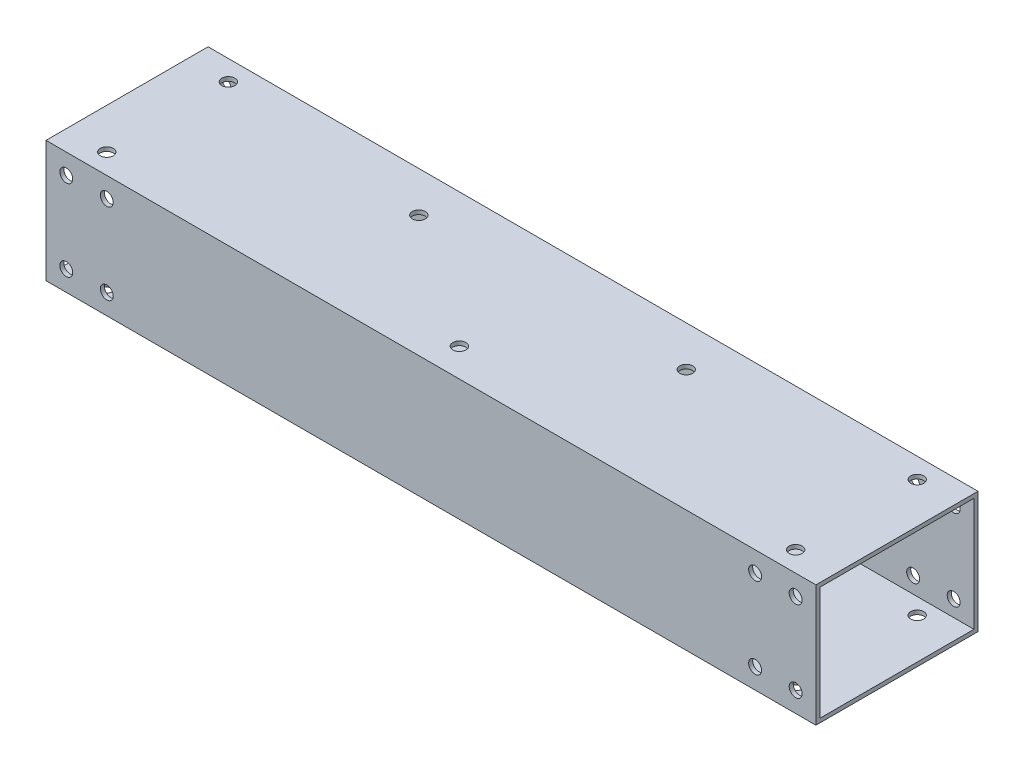
from build123d import *

# Parameters (mm, degrees)
SKETCH_1_W               = 40
SKETCH_1_H               = 30
SKETCH_1_W_2             = 38
SKETCH_1_H_2             = 28
EXTRUDE_1_DEPTH          = 95
CUT_EXTRUDE_1_DEPTH      = 102.612007165
CUT_EXTRUDE_1_DEPTH_BACK = 102.612007165
SKETCH_2_R               = 1.6
SKETCH_3_R               = 1.6
CUT_EXTRUDE_2_DEPTH      = 105.16333328


with BuildPart() as part:
    # 草图1 → 凸台-拉伸1 (new, symmetric)
    with BuildSketch(Plane(origin=(0, 0, 0), x_dir=(0, 0, -1), z_dir=(1, 0, 0))):
        Rectangle(SKETCH_1_W, SKETCH_1_H)
        Rectangle(SKETCH_1_W_2, SKETCH_1_H_2, mode=Mode.SUBTRACT)
    extrude(amount=EXTRUDE_1_DEPTH, both=True)

    # 草图2 → 切除-拉伸1 (cut, two sides: drawn at the far end of the back side and taken through both)
    with BuildSketch(Plane(origin=(0, 15, 0), x_dir=(1, 0, 0), z_dir=(0, 1, 0)).offset(-CUT_EXTRUDE_1_DEPTH_BACK)):
        with Locations(Location((0, -13, 0), (0, 0, 270))):
            Circle(SKETCH_2_R)
        with Locations(Location((-33, 10, 0), (0, 0, 270))):
            Circle(SKETCH_2_R)
        with Locations(Location((33, 10, 0), (0, 0, 270))):
            Circle(SKETCH_2_R)
        with Locations(Location((-85, 15, 0), (0, 0, 270))):
            Circle(SKETCH_2_R)
        with Locations(Location((-85, -15, 0), (0, 0, 270))):
            Circle(SKETCH_2_R)
        with Locations(Location((85, -15, 0), (0, 0, 270))):
            Circle(SKETCH_2_R)
        with Locations(Location((85, 15, 0), (0, 0, 270))):
            Circle(SKETCH_2_R)
    extrude(amount=CUT_EXTRUDE_1_DEPTH + CUT_EXTRUDE_1_DEPTH_BACK, mode=Mode.SUBTRACT)

    # 草图3 → 切除-拉伸2 (cut, through all)
    with BuildSketch(Plane.XY.offset(20)):
        with Locations((-90, 10)):
            Circle(SKETCH_3_R)
        with Locations(Location((-90, -10, 0), (0, 0, 270))):
            Circle(SKETCH_3_R)
        with Locations((-80, 10)):
            Circle(SKETCH_3_R)
        with Locations(Location((-80, -10, 0), (0, 0, 270))):
            Circle(SKETCH_3_R)
        with Locations((80, -10)):
            Circle(SKETCH_3_R)
        with Locations(Location((80, 10, 0), (0, 0, 270))):
            Circle(SKETCH_3_R)
        with Locations((90, -10)):
            Circle(SKETCH_3_R)
        with Locations(Location((90, 10, 0), (0, 0, 270))):
            Circle(SKETCH_3_R)
    extrude(amount=-CUT_EXTRUDE_2_DEPTH, mode=Mode.SUBTRACT)


solid = part.part
